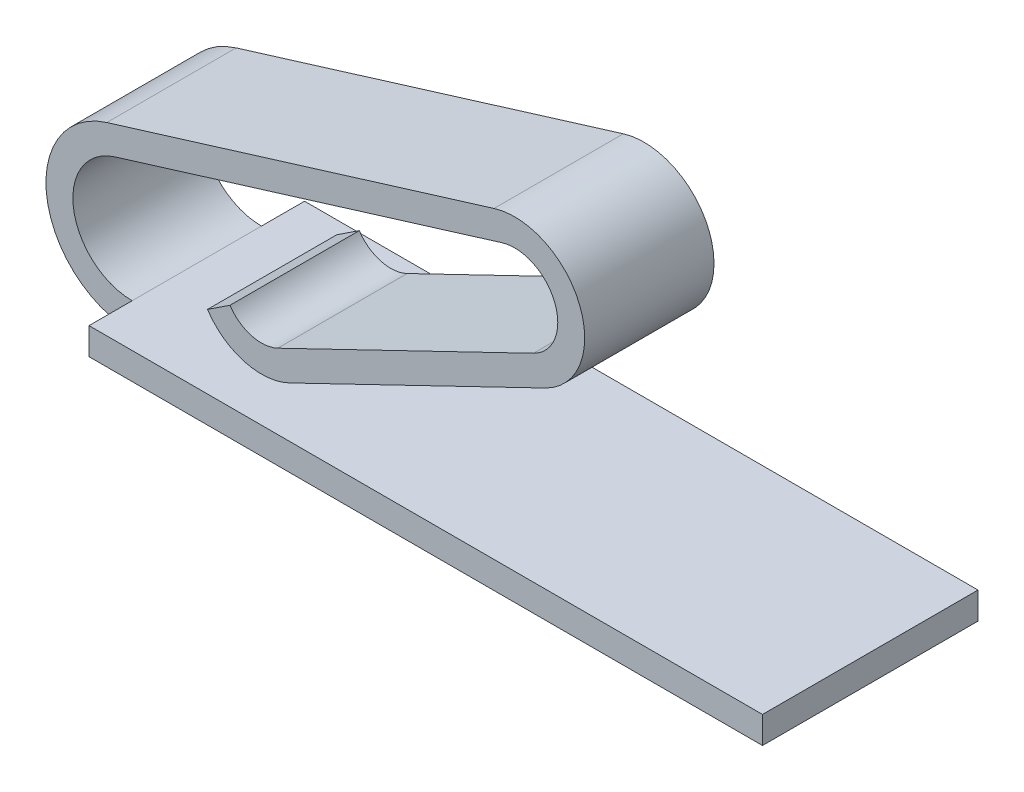
from build123d import *

# Parameters (mm, degrees)
SKETCH_1_W       = 6.25
SKETCH_1_H       = 2
EXTRUDE_1_DEPTH  = 0.25
EXTRUDE_10_DEPTH = 0.6


with BuildPart() as part:
    # Эскиз1 → Бобышка-Вытянуть1 (new body)
    with BuildSketch(Plane(origin=(0, 0, 0), x_dir=(1, 0, 0), z_dir=(0, 1, 0))):
        Rectangle(SKETCH_1_W, SKETCH_1_H)
    extrude(amount=EXTRUDE_1_DEPTH)

    # Эскиз2 → Бобышка-Вытянуть10 (add, symmetric)
    with BuildSketch(Plane.XY):
        with BuildLine():
            Line((-3.360414863, 1.564578212), (0.233725424, 2.671219797))
            ThreePointArc((0.233725424, 2.671219797), (1.030014488, 2.287607806), (0.707586035, 1.464641022))
            Line((0.707586035, 1.464641022), (-1.664151352, 0.319668636))
            ThreePointArc((-1.664151352, 0.319668636), (-2.084532595, 0.281597587), (-2.425958589, 0.529787202))
            Line((-2.425958589, 0.529787202), (-2.217225844, 0.667375868))
            ThreePointArc((-2.217225844, 0.667375868), (-2.018060681, 0.522598593), (-1.772838289, 0.544806704))
            Line((-1.772838289, 0.544806704), (0.598899099, 1.689779091))
            ThreePointArc((0.598899099, 1.689779091), (0.797316608, 2.196220188), (0.307292568, 2.432289106))
            Line((0.307292568, 2.432289106), (-3.286847719, 1.325647521))
            ThreePointArc((-3.286847719, 1.325647521), (-3.668877806, 0.718165216), (-3.125, 0.25))
            Line((-3.125, 0.25), (-3.125, 0))
            ThreePointArc((-3.125, 0), (-3.916094991, 0.680967587), (-3.360414863, 1.564578212))
        make_face()
    extrude(amount=EXTRUDE_10_DEPTH, both=True)


solid = part.part
